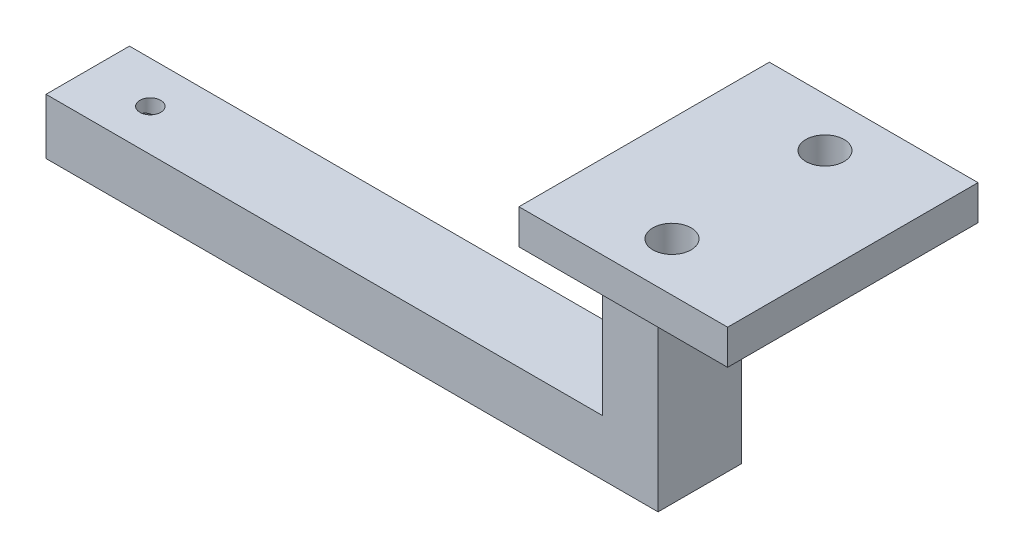
from build123d import *

# Parameters (mm, degrees)
BOSS_EXTRUDE1_DEPTH = 12
SKETCH2_R           = 1.5
CUT_EXTRUDE1_DEPTH  = 12
SKETCH3_R           = 2.25
CUT_EXTRUDE2_DEPTH  = 9
SKETCH4_W           = 36
SKETCH4_H           = 5
BOSS_EXTRUDE2_DEPTH = 30
SKETCH5_R           = 2.75
CUT_EXTRUDE3_DEPTH  = 30


with BuildPart() as part:
    # Sketch1 → Boss-Extrude1 (new body)
    with BuildSketch(Plane.XY):
        Polygon((0, 0), (0, 40), (-8, 40), (-8, 8), (-88, 8), (-88, 0), align=None)
    extrude(amount=BOSS_EXTRUDE1_DEPTH)

    # Sketch2 → Cut-Extrude1 (cut)
    with BuildSketch(Plane(origin=(0, 8, 0), x_dir=(1, 0, 0), z_dir=(0, 1, 0))):
        with Locations(Location((-79, -6, 0), (0, 0, 180))):
            Circle(SKETCH2_R)
    extrude(amount=-CUT_EXTRUDE1_DEPTH, mode=Mode.SUBTRACT)

    # Sketch3 → Cut-Extrude2 (cut)
    with BuildSketch(Plane.ZY.offset(88)):
        with Locations((6, 4)):
            Circle(SKETCH3_R)
    extrude(amount=-CUT_EXTRUDE2_DEPTH, mode=Mode.SUBTRACT)

    # Sketch4 → Boss-Extrude2 (add)
    with BuildSketch(Plane(origin=(-8, 0, 0), x_dir=(0, 0, -1), z_dir=(1, 0, 0))):
        with Locations((-6, 37.5)):
            Rectangle(SKETCH4_W, SKETCH4_H)
    extrude(amount=BOSS_EXTRUDE2_DEPTH)

    # Sketch5 → Cut-Extrude3 (cut)
    with BuildSketch(Plane(origin=(0, 40, 0), x_dir=(1, 0, 0), z_dir=(0, 1, 0))):
        with Locations(Location((7, -17, 0), (0, 0, 180))):
            Circle(SKETCH5_R)
        with Locations(Location((7, 5, 0), (0, 0, 180))):
            Circle(SKETCH5_R)
    extrude(amount=-CUT_EXTRUDE3_DEPTH, mode=Mode.SUBTRACT)


solid = part.part
